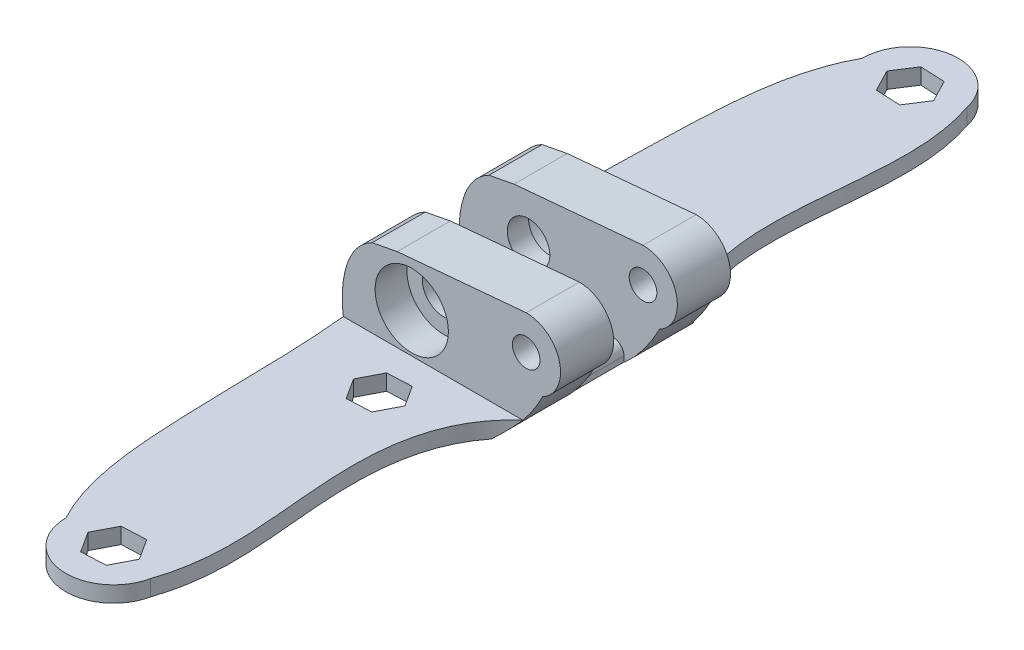
from build123d import *

# Parameters (mm, degrees)
SKETCH1_R           = 6.9
SKETCH1_R_2         = 2.6
BOSS_EXTRUDE1_DEPTH = 10
BOSS_EXTRUDE2_DEPTH = 12
SKETCH3_R           = 7
SKETCH3_R_2         = 4
BOSS_EXTRUDE3_DEPTH = 4
BOSS_EXTRUDE4_DEPTH = 84
BOSS_EXTRUDE5_DEPTH = 84
CUT_EXTRUDE1_DEPTH  = 190.323263107
SCALE1_SCALE        = 1.5


with BuildPart() as part:
    # Sketch1 → Boss-Extrude1 (new body)
    with BuildSketch(Plane.XY):
        with BuildLine():
            Line((-155.070766667, -34.03543395), (-139.182010536, -34.03543395))
            Line((-139.182010536, -34.03543395), (-124.735717634, -34.03543395))
            add(Edge.make_bspline(
                [(-124.735717634, -34.03543395), (-120.868070652, -30.634901056), (-118.110731489, -25.337058748)],
                knots=[0.604913823, 0.604913823, 0.604913823, 1, 1, 1], degree=2))
            ThreePointArc((-118.110731489, -25.337058748), (-114.956411592, -18.057608365), (-121.224300514, -13.194101363))
            Line((-121.224300514, -13.194101363), (-122.374915538, -13.297224598))
            Line((-122.374915538, -13.297224598), (-145.504342678, -15.370186717))
            add(Edge.make_bspline(
                [(-145.504342678, -15.370186717), (-147.665446471, -15.751951197), (-150.237941893, -16.278752791)],
                knots=[0, 0, 0, 0.143499102, 0.143499102, 0.143499102], degree=2))
            add(Edge.make_bspline(
                [(-150.237941893, -16.278752791), (-156.331446907, -19.412430802), (-156.587305002, -28.504886835), (-155.070766667, -34.03543395)],
                knots=[0, 0, 0, 0, 1, 1, 1, 1], degree=3))
        make_face()
        with Locations((-142.777717077, -23.619181221)):
            Circle(SKETCH1_R, mode=Mode.SUBTRACT)
        with Locations((-121.224300514, -19.664754316)):
            Circle(SKETCH1_R_2, mode=Mode.SUBTRACT)
    boss_extrude1 = extrude(amount=BOSS_EXTRUDE1_DEPTH)

    # Sketch2 → Boss-Extrude2 (add)
    with BuildSketch(Plane(origin=(0, 0, 0), x_dir=(-1, 0, 0), z_dir=(0, 0, -1))):
        with BuildLine():
            Line((124.810828249, -34.03543395), (124.810828249, -33.03543395))
            ThreePointArc((124.810828249, -33.03543395), (125.396614687, -31.621220388), (126.810828249, -31.03543395))
            Line((126.810828249, -31.03543395), (155.660238601, -31.03543395))
            add(Edge.make_bspline(
                [(155.660238601, -31.03543395), (155.453340821, -32.220849379), (155.070766667, -34.03543395)],
                knots=[0.469279702, 0.469279702, 0.469279702, 1.113861257, 1.113861257, 1.113861257], degree=2))
            Line((155.070766667, -34.03543395), (124.810828249, -34.03543395))
        make_face()
    extrude(amount=BOSS_EXTRUDE2_DEPTH)

    # Mirror1: Boss-Extrude1 across plane
    add(boss_extrude1.mirror(Plane(origin=(0, 0, -6), x_dir=(1, 0, 0), z_dir=(0, 0, -1))))

    # Sketch3 → Boss-Extrude3 (add)
    with BuildSketch(Plane(origin=(0, 0, 0), x_dir=(-1, 0, 0), z_dir=(0, 0, -1))):
        with Locations((142.777717077, -23.619181221)):
            Circle(SKETCH3_R)
        with Locations((142.777717077, -23.619181221)):
            Circle(SKETCH3_R_2, mode=Mode.SUBTRACT)
    boss_extrude3 = extrude(amount=-BOSS_EXTRUDE3_DEPTH)

    # Mirror2: Boss-Extrude3 across plane
    add(boss_extrude3.mirror(Plane(origin=(0, 0, -6), x_dir=(1, 0, 0), z_dir=(0, 0, -1))))

    # Sketch4 → Boss-Extrude4 (add)
    with BuildSketch(Plane.XY.offset(10)):
        with BuildLine():
            add(Edge.make_bspline(
                [(-155.660238601, -31.03543395), (-155.52477055, -32.104378324), (-155.322110933, -33.11882586), (-155.070766667, -34.03543395)],
                knots=[0.834264482, 0.834264482, 0.834264482, 0.834264482, 1, 1, 1, 1], degree=3))
            Line((-155.070766667, -34.03543395), (-124.735717634, -34.03543395))
            add(Edge.make_bspline(
                [(-124.735717634, -34.03543395), (-123.199822379, -32.685036057), (-121.8390218, -31.03543395)],
                knots=[0, 0, 0, 1, 1, 1], degree=2))
            Line((-121.8390218, -31.03543395), (-155.660238601, -31.03543395))
        make_face()
    extrude(amount=BOSS_EXTRUDE4_DEPTH)

    # Sketch5 → Boss-Extrude5 (add)
    with BuildSketch(Plane(origin=(0, 0, -22), x_dir=(-1, 0, 0), z_dir=(0, 0, -1))):
        with BuildLine():
            Line((155.070766667, -34.03543395), (124.735717633, -34.035433949))
            add(Edge.make_bspline(
                [(124.735717633, -34.035433949), (123.199822378, -32.685036056), (121.8390218, -31.03543395)],
                knots=[0, 0, 0, 1, 1, 1], degree=2))
            Line((121.8390218, -31.03543395), (155.660238601, -31.03543395))
            add(Edge.make_bspline(
                [(155.660238601, -31.03543395), (155.52477055, -32.104378324), (155.322110933, -33.11882586), (155.070766667, -34.03543395)],
                knots=[0.834264482, 0.834264482, 0.834264482, 0.834264482, 1, 1, 1, 1], degree=3))
        make_face()
    extrude(amount=BOSS_EXTRUDE5_DEPTH)

    # Sketch6 → Cut-Extrude1 (cut, through all)
    with BuildSketch(Plane(origin=(0, -31.03543395, 0), x_dir=(1, 0, 0), z_dir=(0, 1, 0))):
        Polygon((-137.786415389, 76.894835229), (-142.400005748, 77.114191864), (-144.516832509, 81.219356636), (-142.02006891, 85.105164771), (-137.406478551, 84.885808136), (-135.289651791, 80.780643364), align=None)
        Polygon((-135.289651791, 30.780643364), (-137.786415389, 26.894835229), (-142.400005748, 27.114191864), (-144.516832509, 31.219356636), (-142.02006891, 35.105164771), (-137.406478551, 34.885808136), align=None)
        with BuildLine():
            Line((-155.6602386, 22), (-173.465321409, 22))
            Line((-173.465321409, 22), (-173.465321409, 117.834139367))
            Line((-173.465321409, 117.834139367), (-100.430925903, 117.834139367))
            Line((-100.430925903, 117.834139367), (-121.8390218, 22))
            add(Edge.make_bspline(
                [(-121.8390218, 22), (-130.237957541, 29.288236007), (-131.708688401, 51.819501052), (-127.475857655, 72.230953717), (-131.071963897, 82.863468574)],
                knots=[0, 0, 0, 0, 0.490729359, 1, 1, 1, 1], degree=3))
            ThreePointArc((-131.071963897, 82.863468574), (-140.840035974, 89.976993263), (-148.928982602, 81))
            add(Edge.make_bspline(
                [(-148.928982602, 81), (-152.625386512, 74.081760345), (-155.262352814, 54.105117148), (-154.402874629, 34.24459948), (-155.6602386, 22)],
                knots=[0, 0, 0, 0, 0.385424941, 1, 1, 1, 1], degree=3))
        make_face()
        with BuildLine():
            Line((-100.430925903, -105.834139367), (-121.8390218, -10))
            add(Edge.make_bspline(
                [(-121.8390218, -10), (-130.237957541, -17.288236007), (-131.708688401, -39.819501052), (-127.475857655, -60.230953717), (-131.071963897, -70.863468574)],
                knots=[0, 0, 0, 0, 0.490729359, 1, 1, 1, 1], degree=3))
            ThreePointArc((-131.071963897, -70.863468574), (-140.840035974, -77.976993263), (-148.928982602, -69))
            add(Edge.make_bspline(
                [(-148.928982602, -69), (-152.625386512, -62.081760345), (-155.262352814, -42.105117148), (-154.402874629, -22.24459948), (-155.6602386, -10)],
                knots=[0, 0, 0, 0, 0.385424941, 1, 1, 1, 1], degree=3))
            Line((-155.6602386, -10), (-173.465321409, -10))
            Line((-173.465321409, -10), (-173.465321409, -105.834139367))
            Line((-173.465321409, -105.834139367), (-100.430925903, -105.834139367))
        make_face()
        Polygon((-142.02006891, -23.105164771), (-137.406478551, -22.885808136), (-135.289651791, -18.780643364), (-137.786415389, -14.894835229), (-142.400005748, -15.114191864), (-144.516832509, -19.219356636), align=None)
        Polygon((-135.289651791, -68.780643364), (-137.786415389, -64.894835229), (-142.400005748, -65.114191864), (-144.516832509, -69.219356636), (-142.02006891, -73.105164771), (-137.406478551, -72.885808136), align=None)
    extrude(amount=-CUT_EXTRUDE1_DEPTH, mode=Mode.SUBTRACT)


with BuildPart() as part_1:
    # Scale1: scaled about (-137.903774464, -28.080076636, -5.999999982)
    add(part.part.scale(SCALE1_SCALE).moved(Location((68.951887232, 14.040038318, 2.999999991))))


solid = part_1.part
